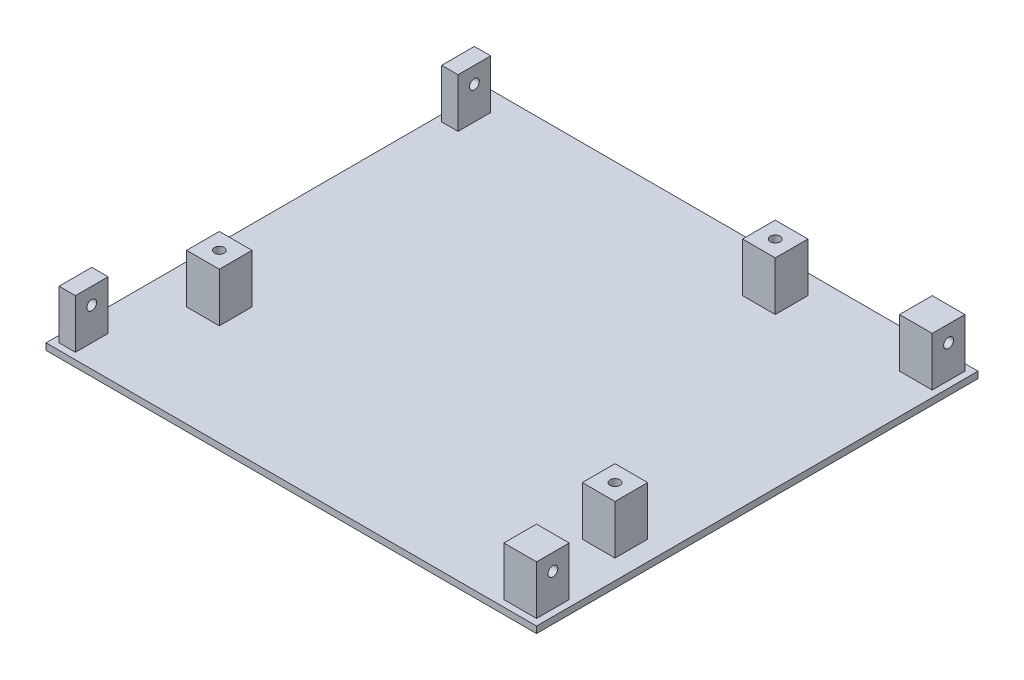
from build123d import *

# Parameters (mm, degrees)
CROQUIS6_W              = 150
CROQUIS6_H              = 135
SALIENTE_EXTRUIR6_DEPTH = 2
CROQUIS8_W              = 5
CROQUIS8_H              = 10
CROQUIS8_W_2            = 10
CROQUIS8_R              = 1.5
SALIENTE_EXTRUIR7_DEPTH = 15
CROQUIS9_R              = 1.5
CORTAR_EXTRUIR1_DEPTH   = 10
CORTAR_EXTRUIR2_START   = -10
CROQUIS10_R             = 1.5
CORTAR_EXTRUIR2_DEPTH   = 10


with BuildPart() as part:
    # Croquis6 → Saliente-Extruir6 (new body)
    with BuildSketch(Plane(origin=(0, 0, 0), x_dir=(1, 0, 0), z_dir=(0, 1, 0))):
        with Locations((75, 67.5)):
            Rectangle(CROQUIS6_W, CROQUIS6_H)
    extrude(amount=-SALIENTE_EXTRUIR6_DEPTH)

    # Croquis8 → Saliente-Extruir7 (add)
    # profile 1 of 7: a face of its own
    with BuildSketch(Plane(origin=(0, 0, 0), x_dir=(1, 0, 0), z_dir=(0, 1, 0))):
        with Locations((4.5, 124)):
            Rectangle(CROQUIS8_W, CROQUIS8_H)
    # profile 2 of 7: a face of its own
    with BuildSketch(Plane(origin=(0, 0, 0), x_dir=(1, 0, 0), z_dir=(0, 1, 0))):
        with Locations((4.5, 7)):
            Rectangle(CROQUIS8_W, CROQUIS8_H)
    # profile 3 of 7: a face of its own
    with BuildSketch(Plane(origin=(0, 0, 0), x_dir=(1, 0, 0), z_dir=(0, 1, 0))):
        with Locations((143, 128)):
            Rectangle(CROQUIS8_W_2, CROQUIS8_H)
    # profile 4 of 7: a face of its own
    with BuildSketch(Plane(origin=(0, 0, 0), x_dir=(1, 0, 0), z_dir=(0, 1, 0))):
        with Locations((143, 7)):
            Rectangle(CROQUIS8_W_2, CROQUIS8_H)
    # profile 5 of 7: a face of its own
    with BuildSketch(Plane(origin=(0, 0, 0), x_dir=(1, 0, 0), z_dir=(0, 1, 0))):
        with Locations((139, 35)):
            Rectangle(CROQUIS8_W_2, CROQUIS8_H)
        with Locations(Location((139, 35, 0), (0, 0, 270))):
            Circle(CROQUIS8_R, mode=Mode.SUBTRACT)
    # profile 6 of 7: a face of its own
    with BuildSketch(Plane(origin=(0, 0, 0), x_dir=(1, 0, 0), z_dir=(0, 1, 0))):
        with Locations((17, 36)):
            Rectangle(CROQUIS8_W_2, CROQUIS8_H)
        with Locations(Location((17, 36, 0), (0, 0, 270))):
            Circle(CROQUIS8_R, mode=Mode.SUBTRACT)
    # profile 7 of 7: a face of its own
    with BuildSketch(Plane(origin=(0, 0, 0), x_dir=(1, 0, 0), z_dir=(0, 1, 0))):
        with Locations((99, 124)):
            Rectangle(CROQUIS8_W_2, CROQUIS8_H)
        with Locations(Location((99, 124, 0), (0, 0, 270))):
            Circle(CROQUIS8_R, mode=Mode.SUBTRACT)
    extrude(amount=SALIENTE_EXTRUIR7_DEPTH)

    # Croquis9 → Cortar-Extruir1 (cut)
    with BuildSketch(Plane.ZY):
        with Locations((-124, 10)):
            Circle(CROQUIS9_R)
        with Locations((-7, 10)):
            Circle(CROQUIS9_R)
    extrude(amount=-CORTAR_EXTRUIR1_DEPTH, mode=Mode.SUBTRACT)

    # Croquis10 → Cortar-Extruir2 (cut)
    with BuildSketch(Plane(origin=(148, 0, 0), x_dir=(0, 0, -1), z_dir=(1, 0, 0)).offset(CORTAR_EXTRUIR2_START)):
        with Locations(Location((7, 10, 0), (0, 0, 180))):
            Circle(CROQUIS10_R)
        with Locations((128, 10)):
            Circle(CROQUIS10_R)
    extrude(amount=CORTAR_EXTRUIR2_DEPTH, mode=Mode.SUBTRACT)


solid = part.part
